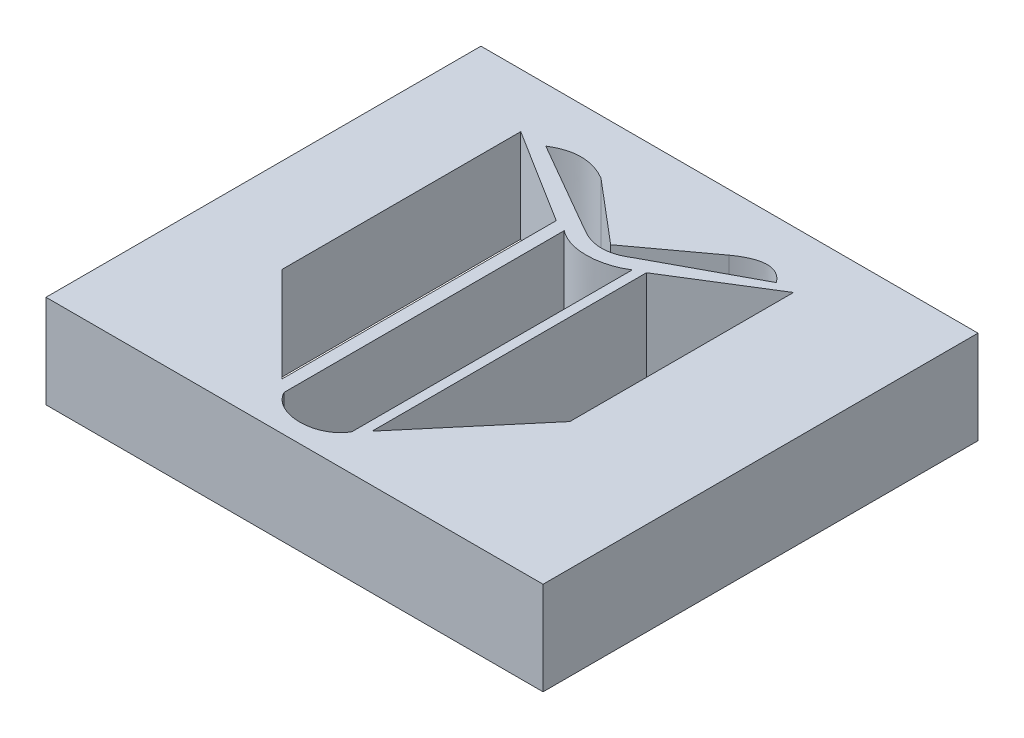
from build123d import *

# Parameters (mm, degrees)
SKETCH2_W           = 16
SKETCH2_H           = 14
BOSS_EXTRUDE1_DEPTH = 3
CUT_EXTRUDE1_DEPTH  = 3


with BuildPart() as part:
    # Sketch2 → Boss-Extrude1 (new body)
    with BuildSketch(Plane(origin=(0, 0, 0), x_dir=(1, 0, 0), z_dir=(0, 1, 0))):
        with Locations((-34.802547771, 15.318471338)):
            Rectangle(SKETCH2_W, SKETCH2_H)
    extrude(amount=BOSS_EXTRUDE1_DEPTH)

    # Sketch4 → Cut-Extrude1 (cut)
    with BuildSketch(Plane(origin=(0, 3, 0), x_dir=(1, 0, 0), z_dir=(0, 1, 0))):
        with BuildLine():
            Line((-36.318911755, 18.516121759), (-36.318911755, 9.495766822))
            add(Edge.make_bspline(
                [(-36.318911755, 9.495766822), (-35.913871603, 8.720893634), (-34.543281821, 8.741015584), (-34.130046647, 9.495766822)],
                knots=[0, 0, 0, 0, 1, 1, 1, 1], degree=3))
            Line((-34.130046647, 9.495766822), (-34.130046647, 18.516121759))
            add(Edge.make_bspline(
                [(-36.318911755, 18.516121759), (-35.70959357, 18.038988867), (-34.764466339, 18.114801672), (-34.130046647, 18.516121759)],
                knots=[0, 0, 0, 0, 1, 1, 1, 1], degree=3))
        make_face()
        Polygon((-33.822053837, 18.666521758), (-33.822053837, 9.831273412), (-30.905859423, 13.283968712), (-30.905859423, 20.48178763), align=None)
        Polygon((-36.726560822, 18.666521758), (-36.726560822, 9.831273412), (-39.779226537, 12.883939127), (-39.779226537, 20.575922696), align=None)
        with BuildLine():
            Line((-37.197236152, 20.575922696), (-35.179234522, 18.871490486))
            Line((-35.179234522, 18.871490486), (-35.103321149, 18.927279173))
            Line((-35.103321149, 18.927279173), (-32.988053911, 20.48178763))
            add(Edge.make_bspline(
                [(-32.988053911, 20.48178763), (-31.996391296, 21.194388002), (-31.454997121, 20.48178763)],
                knots=[0, 0, 0, 1, 1, 1], degree=2))
            Line((-31.454997121, 20.48178763), (-34.453871369, 18.871490486))
            add(Edge.make_bspline(
                [(-36.013823893, 18.871490486), (-35.223935459, 18.378867512), (-34.453871369, 18.871490486)],
                knots=[0, 0, 0, 1, 1, 1], degree=2))
            Line((-36.013823893, 18.871490486), (-38.972354542, 20.575922696))
            add(Edge.make_bspline(
                [(-38.972354542, 20.575922696), (-38.119189313, 21.114619825), (-37.197236152, 20.575922696)],
                knots=[0, 0, 0, 1, 1, 1], degree=2))
        make_face()
    extrude(amount=-CUT_EXTRUDE1_DEPTH, mode=Mode.SUBTRACT)


solid = part.part
